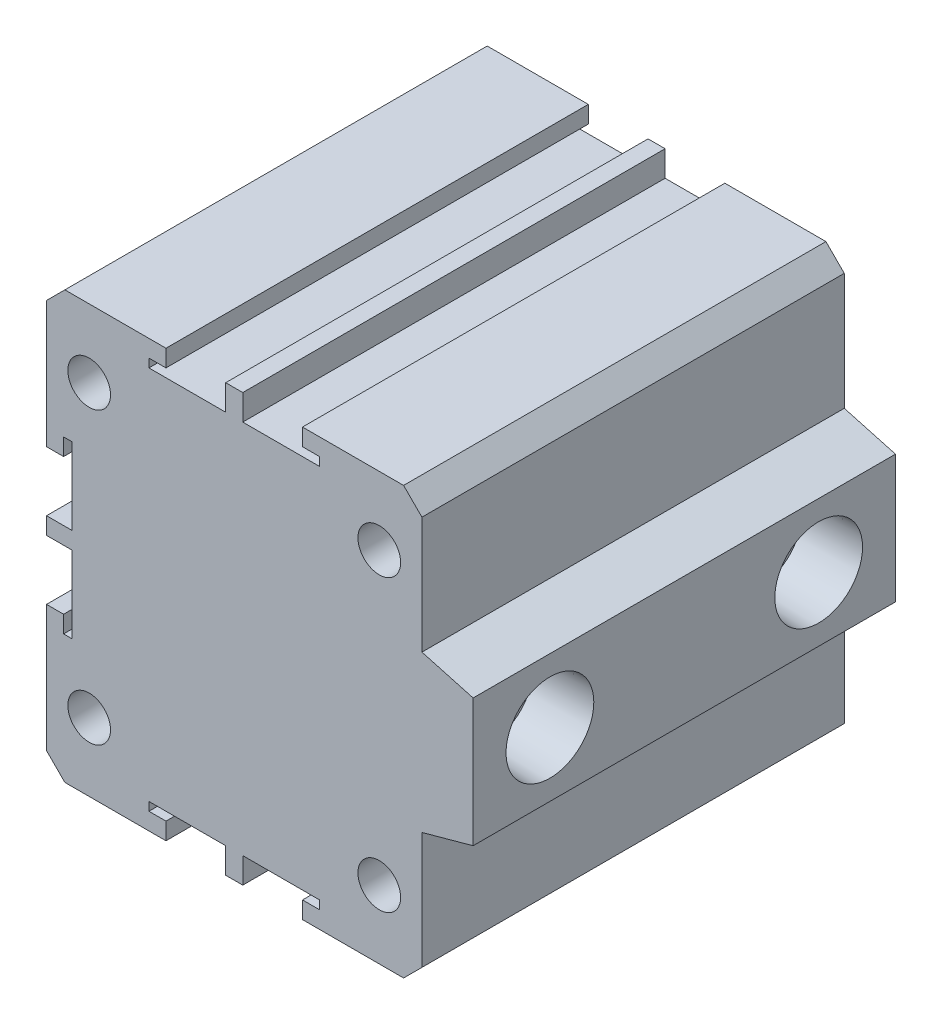
from build123d import *

# Parameters (mm, degrees)
SALIENTE_EXTRUIR1_DEPTH             = 24.75
CROQUIS2_W                          = 11
CROQUIS2_H                          = 3
CROQUIS3_R                          = 6
CORTAR_EXTRUIR1_DEPTH               = 46
CORTAR_EXTRUIR2_START               = -5
CROQUIS4_R                          = 16
CROQUIS4_R_2                        = 11
CORTAR_EXTRUIR2_DEPTH               = 5
TALADRO_ROSCADO_M61_D               = 5
TALADRO_ROSCADO_1_8_NPT1_AT_2_COUNT = 2
TALADRO_ROSCADO_1_8_NPT1_AT_2_PITCH = 31.5


with BuildPart() as part:
    # Croquis1 → Saliente-Extruir1 (new, symmetric)
    with BuildSketch(Plane.XY):
        Polygon((8, -23), (8, -25), (19.85, -25), (22, -22.85), (22, -9.15), (28, -7.5), (28, 7.5), (22, 9.15), (22, 22.85), (19.85, 25), (8, 25), (8, 23), (10, 23), (10, 22), (1, 22), (1, 25), (-1, 25), (-1, 22), (-10, 22), (-10, 23), (-8, 23), (-8, 25), (-19.85, 25), (-22, 22.85), (-22, 8), (-20, 8), (-20, 10), (-19, 10), (-19, 1), (-22, 1), (-22, -1), (-19, -1), (-19, -10), (-20, -10), (-20, -8), (-22, -8), (-22, -22.85), (-19.85, -25), (-8, -25), (-8, -23), (-10, -23), (-10, -22), (-1, -22), (-1, -25), (1, -25), (1, -22), (10, -22), (10, -23), align=None)
    extrude(amount=SALIENTE_EXTRUIR1_DEPTH, both=True)

    # Croquis2 → Revolución1 (revolve)
    with BuildSketch(Plane(origin=(0, 0, 0), x_dir=(1, 0, 0), z_dir=(0, 1, 0))):
        with Locations((5.5, 26.25)):
            Rectangle(CROQUIS2_W, CROQUIS2_H)
    revolve(axis=Axis((0, 0, -24.75), (0, 0, -1)))

    # Croquis3 → Cortar-Extruir1 (cut)
    with BuildSketch(Plane(origin=(0, 0, -27.75), x_dir=(-1, 0, 0), z_dir=(0, 0, -1))):
        Circle(CROQUIS3_R)
    extrude(amount=-CORTAR_EXTRUIR1_DEPTH, mode=Mode.SUBTRACT)

    # Croquis4 → Cortar-Extruir2 (cut)
    with BuildSketch(Plane(origin=(0, 0, -24.75), x_dir=(-1, 0, 0), z_dir=(0, 0, -1)).offset(CORTAR_EXTRUIR2_START)):
        Circle(CROQUIS4_R)
        with Locations(Location((0, 0, 0), (0, 0, 180))):
            Circle(CROQUIS4_R_2, mode=Mode.SUBTRACT)
    extrude(amount=CORTAR_EXTRUIR2_DEPTH, mode=Mode.SUBTRACT)

    # Taladro roscado M61 (through all)
    with Locations(Plane(origin=(0, 0, -24.75), x_dir=(-1, 0, 0), z_dir=(0, 0, -1))):
        with Locations((17, -17), (-17, -17), (-17, 17), (17, 17)):
            Hole(TALADRO_ROSCADO_M61_D / 2)

    # Croquis11 → Taladro roscado 1/8 NPT1 (revolve, cut)
    with BuildSketch(Plane(origin=(28, 0, -15.75), x_dir=(0, 0, -1), z_dir=(0, 1, 0))):
        Polygon((0, 0), (0, 14.153468714), (4.2164, 11.62), (4.2164, 6.92), (4.936178933, 6.92), (5.143373, 0), align=None)
    taladro_roscado_1_8_npt1 = revolve(axis=Axis((34.35, 0, -15.75), (-1, 0, 0)), mode=Mode.SUBTRACT)

    # Taladro roscado 1/8 NPT1 at 2: Taladro roscado 1/8 NPT1 ×2
    with Locations(*[(0, 0, i * TALADRO_ROSCADO_1_8_NPT1_AT_2_PITCH) for i in range(1, TALADRO_ROSCADO_1_8_NPT1_AT_2_COUNT)]):
        add(taladro_roscado_1_8_npt1, mode=Mode.SUBTRACT)


solid = part.part
